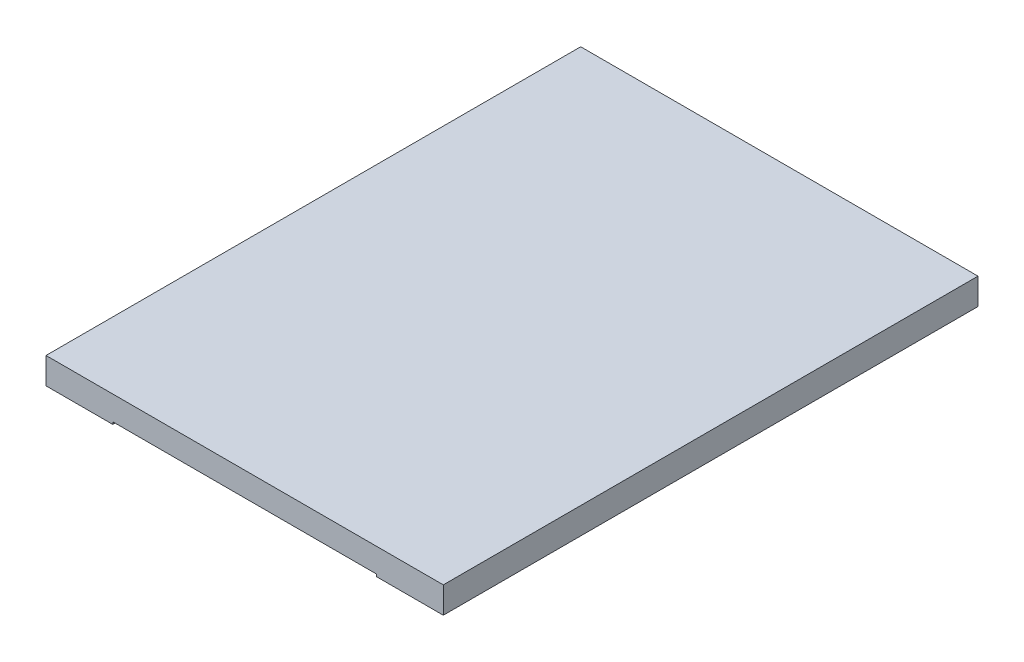
from build123d import *

# Parameters (mm, degrees)
SKETCH_1_W          = 34.7
SKETCH_1_H          = 46.7
EXTRUDE_1_DEPTH     = 2.3
SKETCH_2_W          = 31.83
SKETCH_2_H          = 38.38
SKETCH_2_W_2        = 28.03
SKETCH_2_H_2        = 35.04
CUT_EXTRUDE_1_DEPTH = 0.2
SKETCH_3_W          = 31.83
SKETCH_3_H          = 4.217139833
CUT_EXTRUDE_2_DEPTH = 0.5
SKETCH_4_W          = 23.03
SKETCH_4_H          = 2.692860167
CUT_EXTRUDE_3_DEPTH = 0.2


with BuildPart() as part:
    # Эскиз1 → Бобышка-Вытянуть1 (new body)
    with BuildSketch(Plane(origin=(0, 0, 0), x_dir=(1, 0, 0), z_dir=(0, 1, 0))):
        Rectangle(SKETCH_1_W, SKETCH_1_H)
    extrude(amount=EXTRUDE_1_DEPTH)

    # Эскиз2 → Вырез-Вытянуть1 (cut)
    with BuildSketch(Plane.XZ):
        with Locations((0, -2.75)):
            Rectangle(SKETCH_2_W, SKETCH_2_H)
        with Locations((0, -2.75)):
            Rectangle(SKETCH_2_W_2, SKETCH_2_H_2, mode=Mode.SUBTRACT)
    extrude(amount=-CUT_EXTRUDE_1_DEPTH, mode=Mode.SUBTRACT)

    # Эскиз3 → Вырез-Вытянуть2 (cut)
    with BuildSketch(Plane.XZ):
        with Locations((0, 18.548569916)):
            Rectangle(SKETCH_3_W, SKETCH_3_H)
    extrude(amount=-CUT_EXTRUDE_2_DEPTH, mode=Mode.SUBTRACT)

    # Эскиз4 → Вырез-Вытянуть3 (cut)
    with BuildSketch(Plane.XZ):
        with Locations((0, 22.003569917)):
            Rectangle(SKETCH_4_W, SKETCH_4_H)
    extrude(amount=-CUT_EXTRUDE_3_DEPTH, mode=Mode.SUBTRACT)


solid = part.part
